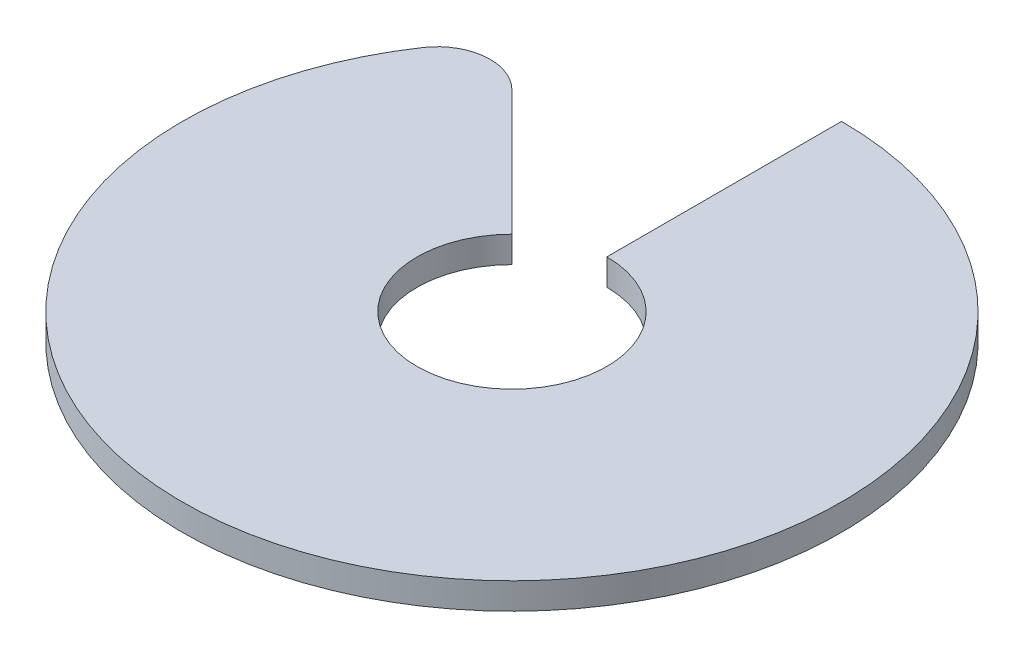
from build123d import *

# Parameters (mm, degrees)
EXTRUDE_1_DEPTH = 5
FILLET_1_R      = 10


with BuildPart() as part:
    # Эскиз1 → Бобышка-Вытянуть1 (new body)
    with BuildSketch(Plane(origin=(0, 0, 0), x_dir=(1, 0, 0), z_dir=(0, 1, 0))):
        with BuildLine():
            Line((-12.727922061, 12.727922061), (-44.194173824, 44.194173824))
            ThreePointArc((-44.194173824, 44.194173824), (23.917714523, -57.742470782), (0, 62.5))
            Line((0, 62.5), (0, 18))
            ThreePointArc((0, 18), (6.888301783, -16.629831585), (-12.727922061, 12.727922061))
        make_face()
    extrude(amount=EXTRUDE_1_DEPTH)

    # Скругление1
    fillet_1_edges = [part.edges().sort_by_distance(p)[0] for p in [
        (-44.194173824, 2.5, -44.194173824),
    ]]
    fillet(fillet_1_edges, radius=FILLET_1_R)


solid = part.part
